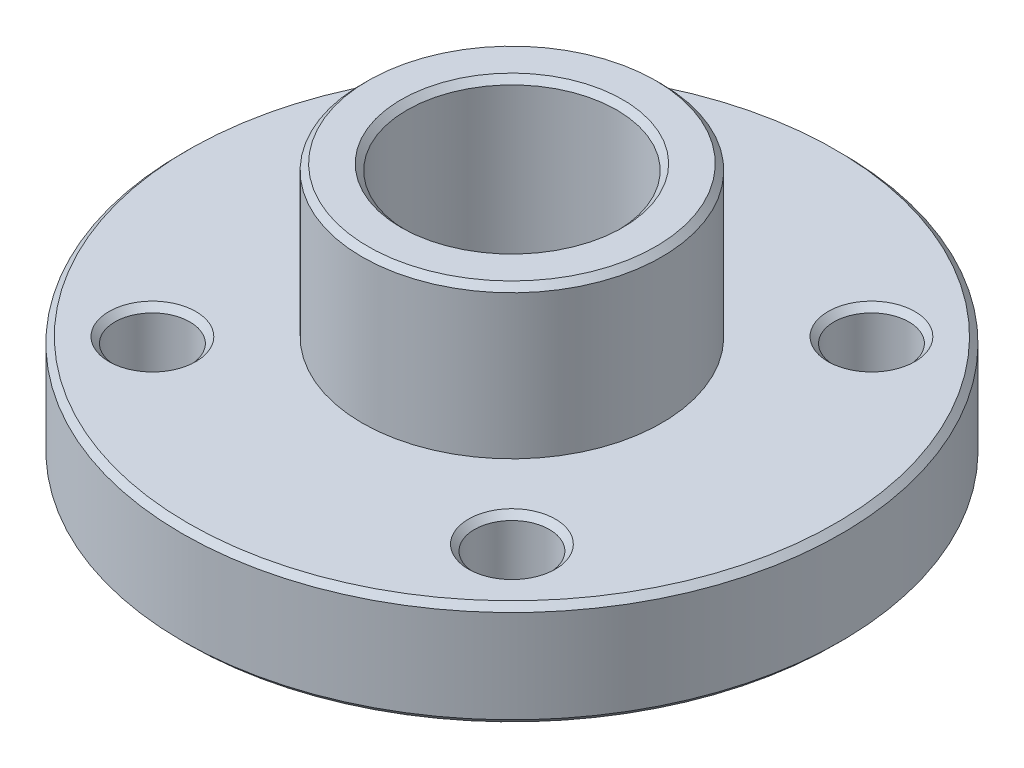
from build123d import *

# Parameters (mm, degrees)
SKETCH1_R           = 5
SKETCH1_R_2         = 3.5
BOSS_EXTRUDE1_DEPTH = 10.5
SKETCH4_R           = 11
SKETCH4_R_2         = 5
BOSS_EXTRUDE2_DEPTH = 3.5
SKETCH5_R           = 1.25
CUT_EXTRUDE2_DEPTH  = 19.768324379
CHAMFER1_SIZE       = 0.2


with BuildPart() as part:
    # Sketch1 → Boss-Extrude1 (new body)
    with BuildSketch(Plane(origin=(0, 0, 0), x_dir=(1, 0, 0), z_dir=(0, 1, 0))):
        with Locations(Location((0, 0, 0), (0, 0, 90))):
            Circle(SKETCH1_R)
        with Locations(Location((0, 0, 0), (0, 0, 90))):
            Circle(SKETCH1_R_2, mode=Mode.SUBTRACT)
    extrude(amount=BOSS_EXTRUDE1_DEPTH)

    # Sketch4 → Boss-Extrude2 (add)
    with BuildSketch(Plane(origin=(0, 2, 0), x_dir=(1, 0, 0), z_dir=(0, 1, 0))):
        with Locations(Location((0, 0, 0), (0, 0, 270))):
            Circle(SKETCH4_R)
        with Locations(Location((0, 0, 0), (0, 0, 90))):
            Circle(SKETCH4_R_2, mode=Mode.SUBTRACT)
    extrude(amount=BOSS_EXTRUDE2_DEPTH)

    # Sketch5 → Cut-Extrude2 (cut, through all)
    with BuildSketch(Plane(origin=(0, 0, 0), x_dir=(1, 0, 0), z_dir=(0, 1, 0))):
        with Locations(Location((-6, 6, 0), (0, 0, 90))):
            Circle(SKETCH5_R)
        with Locations(Location((6, 6, 0), (0, 0, 90))):
            Circle(SKETCH5_R)
        with Locations(Location((6, -6, 0), (0, 0, 90))):
            Circle(SKETCH5_R)
        with Locations(Location((-6, -6, 0), (0, 0, 90))):
            Circle(SKETCH5_R)
    extrude(amount=CUT_EXTRUDE2_DEPTH, mode=Mode.SUBTRACT)

    # Chamfer1
    chamfer1_edges = [part.edges().sort_by_distance(p)[0] for p in [
        (0, 5.5, -11),
        (0, 2, -11),
        (-6, 5.5, -4.75),
        (-6, 2, -4.75),
        (0, 0, 5),
        (6, 5.5, -4.75),
        (6, 2, -4.75),
        (6, 5.5, 7.25),
        (6, 2, 7.25),
        (-6, 5.5, 7.25),
        (-6, 2, 7.25),
        (0, 10.5, 5),
        (0, 0, 3.5),
        (0, 10.5, 3.5),
    ]]
    chamfer(chamfer1_edges, length=CHAMFER1_SIZE)


solid = part.part
